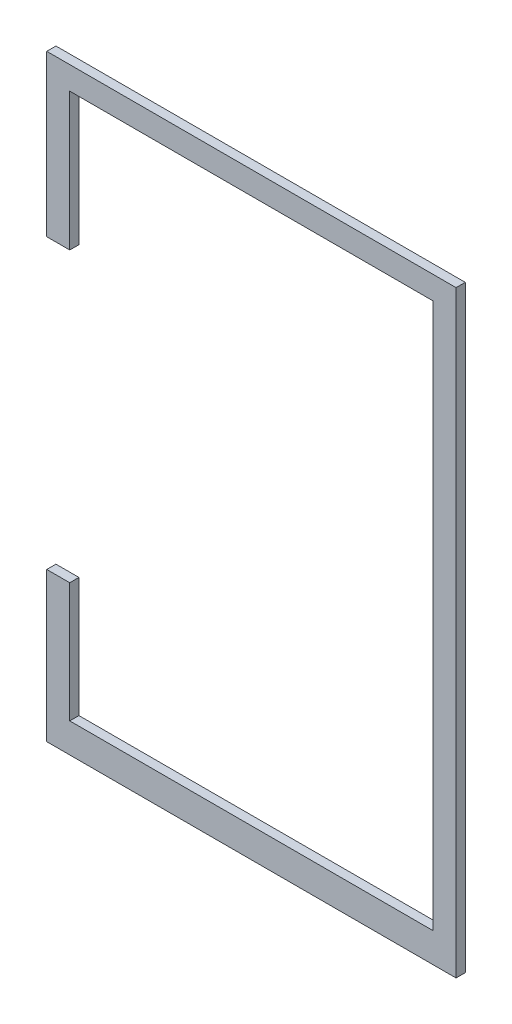
from build123d import *

# Parameters (mm, degrees)
BOSS_EXTRUDE1_DEPTH = 4


with BuildPart() as part:
    # Sketch3 → Boss-Extrude1 (new body)
    with BuildSketch(Plane(origin=(0, 0, 0), x_dir=(0, 1, 0), z_dir=(0, 0, 1))):
        Polygon((125.255410605, 97.12248794), (55.422407136, 97.12248794), (55.422407136, 87.12248794), (115.255410605, 87.12248794), (115.255410605, -70.87751206), (-121.912372197, -70.87751206), (-121.912372197, 87.12248794), (-69.877046163, 87.12248794), (-69.877046163, 97.12248794), (-134.744589395, 97.12248794), (-134.744589395, -80.87751206), (125.255410605, -80.87751206), align=None)
    extrude(amount=-BOSS_EXTRUDE1_DEPTH)


solid = part.part
